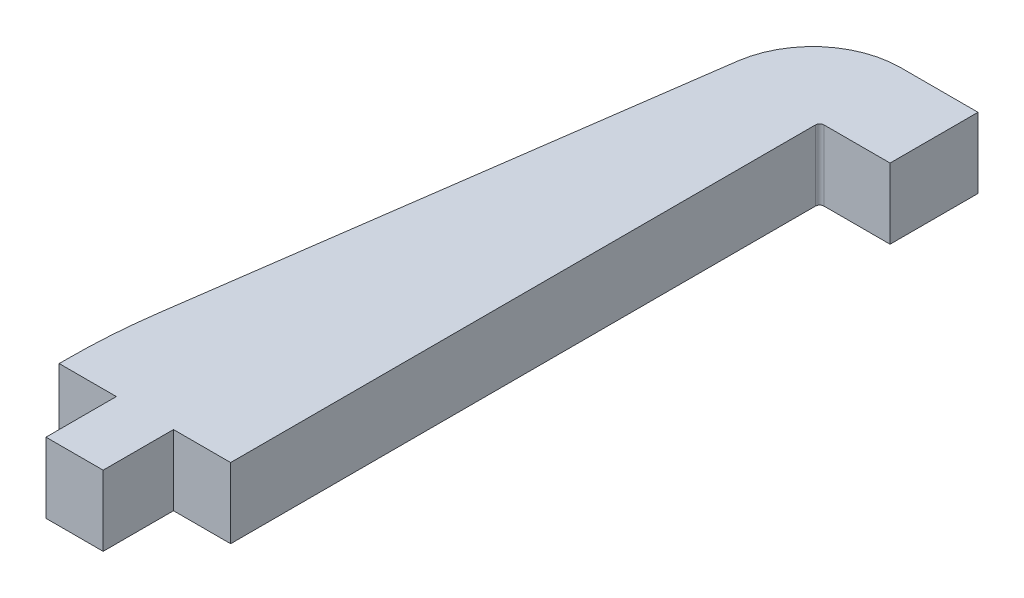
from build123d import *

# Parameters (mm, degrees)
BOSS_EXTRUDE1_DEPTH = 8
CHAMFER1_SIZE       = 10
CHAMFER1_SIZE2      = 71.153697224
FILLET1_R           = 10
FILLET2_R           = 70
FILLET3_R           = 0.5


with BuildPart() as part:
    # Sketch1 → Boss-Extrude1 (new body)
    with BuildSketch(Plane(origin=(0, 0, 0), x_dir=(1, 0, 0), z_dir=(0, 1, 0))):
        Polygon((0, 77), (0, 0), (6.5, 0), (6.5, -8), (13, -8), (13, 0), (19.5, 0), (19.5, 67), (27.5, 67), (27.5, 77), align=None)
    extrude(amount=BOSS_EXTRUDE1_DEPTH)

    # Chamfer1
    chamfer1_edges = [part.edges().sort_by_distance(p)[0] for p in [
        (0, 4, -77),
    ]]
    chamfer1_side = [part.faces().sort_by_distance(p)[0] for p in [
        (13.75, 4, -77),
    ]]
    chamfer(chamfer1_edges, length=CHAMFER1_SIZE, length2=CHAMFER1_SIZE2, reference=chamfer1_side[0])

    # Fillet1
    fillet1_edges = [part.edges().sort_by_distance(p)[0] for p in [
        (10, 4, -77),
    ]]
    fillet(fillet1_edges, radius=FILLET1_R)

    # Fillet2
    fillet2_edges = [part.edges().sort_by_distance(p)[0] for p in [
        (0, 4, -5.846302776),
    ]]
    fillet(fillet2_edges, radius=FILLET2_R)

    # Fillet3
    fillet3_edges = [part.edges().sort_by_distance(p)[0] for p in [
        (19.5, 4, -67),
    ]]
    fillet(fillet3_edges, radius=FILLET3_R)


solid = part.part
